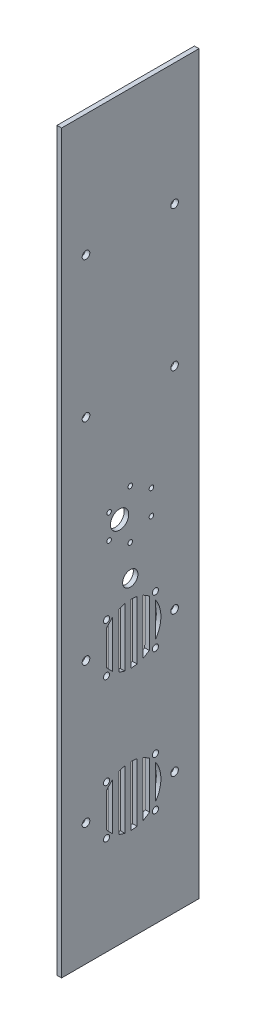
from build123d import *

# Parameters (mm, degrees)
CROQUIS3_W              = 90
CROQUIS3_H              = 482
CROQUIS3_R              = 2.5
CROQUIS3_R_2            = 6
CROQUIS3_R_3            = 1.5
CROQUIS3_R_4            = 5
CROQUIS3_R_5            = 2
SALIENTE_EXTRUIR1_DEPTH = 3


with BuildPart() as part:
    # Croquis3 → Saliente-Extruir1 (new body)
    with BuildSketch(Plane.ZY.offset(90.501614904)):
        with Locations((-43, 944.628389678)):
            Rectangle(CROQUIS3_W, CROQUIS3_H)
        with Locations((-72, 1105.628389678)):
            Circle(CROQUIS3_R, mode=Mode.SUBTRACT)
        with Locations((-14, 1105.628389678)):
            Circle(CROQUIS3_R, mode=Mode.SUBTRACT)
        with Locations((-72, 1013.628389678)):
            Circle(CROQUIS3_R, mode=Mode.SUBTRACT)
        with Locations((-14, 1013.628389678)):
            Circle(CROQUIS3_R, mode=Mode.SUBTRACT)
        with Locations((-36, 944.628389678)):
            Circle(CROQUIS3_R_2, mode=Mode.SUBTRACT)
        with Locations((-29.136829367, 936.116673787)):
            Circle(CROQUIS3_R_3, mode=Mode.SUBTRACT)
        with Locations((-43, 928.11276849)):
            Circle(CROQUIS3_R_3, mode=Mode.SUBTRACT)
        with Locations((-29.136829367, 952.124484381)):
            Circle(CROQUIS3_R_3, mode=Mode.SUBTRACT)
        with Locations((-43, 960.128389678)):
            Circle(CROQUIS3_R_3, mode=Mode.SUBTRACT)
        with Locations((-56.863170633, 952.124484381)):
            Circle(CROQUIS3_R_3, mode=Mode.SUBTRACT)
        with Locations((-56.863170633, 936.116673787)):
            Circle(CROQUIS3_R_3, mode=Mode.SUBTRACT)
        with Locations((-43, 907.728389678)):
            Circle(CROQUIS3_R_4, mode=Mode.SUBTRACT)
        with Locations((-14, 875.628389678)):
            Circle(CROQUIS3_R, mode=Mode.SUBTRACT)
        with Locations((-27.458426503, 860.118311041)):
            Circle(CROQUIS3_R_5, mode=Mode.SUBTRACT)
        with Locations((-27.458426503, 892.118311041)):
            Circle(CROQUIS3_R_5, mode=Mode.SUBTRACT)
        with Locations((-14, 783.628389678)):
            Circle(CROQUIS3_R, mode=Mode.SUBTRACT)
        with Locations((-27.458426503, 768.118311041)):
            Circle(CROQUIS3_R_5, mode=Mode.SUBTRACT)
        with Locations((-27.458426503, 800.118311041)):
            Circle(CROQUIS3_R_5, mode=Mode.SUBTRACT)
        with Locations((-59.458426503, 768.118311041)):
            Circle(CROQUIS3_R_5, mode=Mode.SUBTRACT)
        with Locations((-72, 783.628389678)):
            Circle(CROQUIS3_R, mode=Mode.SUBTRACT)
        with Locations((-59.458426503, 800.118311041)):
            Circle(CROQUIS3_R_5, mode=Mode.SUBTRACT)
        with Locations((-59.458426503, 860.118311041)):
            Circle(CROQUIS3_R_5, mode=Mode.SUBTRACT)
        with Locations((-72, 875.628389678)):
            Circle(CROQUIS3_R, mode=Mode.SUBTRACT)
        with Locations((-59.458426503, 892.118311041)):
            Circle(CROQUIS3_R_5, mode=Mode.SUBTRACT)
        with BuildLine():
            Line((-59.458426503, 887.421766265), (-59.458426503, 864.814855817))
            ThreePointArc((-59.458426503, 864.814855817), (-63.048426503, 876.118311041), (-59.458426503, 887.421766265))
        make_face(mode=Mode.SUBTRACT)
        Polygon((-55.641915092, 891.4588034), (-55.458426503, 860.633864006), (-51.458426503, 858.236250198), (-51.458426503, 894.000371885), align=None, mode=Mode.SUBTRACT)
        Polygon((-47.458426503, 895.29559187), (-47.458426503, 856.941030212), (-43.458426503, 856.528311041), (-43.458426503, 895.708311041), align=None, mode=Mode.SUBTRACT)
        Polygon((-39.458426503, 856.941030212), (-35.458426503, 858.236250198), (-35.458426503, 894.000371885), (-39.458426503, 895.29559187), align=None, mode=Mode.SUBTRACT)
        Polygon((-31.458426503, 860.633864006), (-31.274937914, 891.4588034), (-27.458426503, 887.421766265), (-27.458426503, 864.814855817), align=None, mode=Mode.SUBTRACT)
        Polygon((-27.458426503, 772.814855817), (-31.274937914, 768.777818683), (-31.458426503, 799.602758077), (-27.458426503, 795.421766265), align=None, mode=Mode.SUBTRACT)
        Polygon((-35.458426503, 766.236250198), (-39.458426503, 764.941030212), (-39.458426503, 803.29559187), (-35.458426503, 802.000371885), align=None, mode=Mode.SUBTRACT)
        Polygon((-43.458426503, 764.528311041), (-47.458426503, 764.941030212), (-47.458426503, 803.29559187), (-43.458426503, 803.708311041), align=None, mode=Mode.SUBTRACT)
        Polygon((-51.458426503, 766.236250198), (-55.641915092, 768.777818683), (-55.458426503, 799.602758077), (-51.458426503, 802.000371885), align=None, mode=Mode.SUBTRACT)
        with BuildLine():
            Line((-59.458426503, 795.421766265), (-59.458426503, 772.814855817))
            ThreePointArc((-59.458426503, 772.814855817), (-63.048426503, 784.118311041), (-59.458426503, 795.421766265))
        make_face(mode=Mode.SUBTRACT)
    extrude(amount=SALIENTE_EXTRUIR1_DEPTH)


solid = part.part
